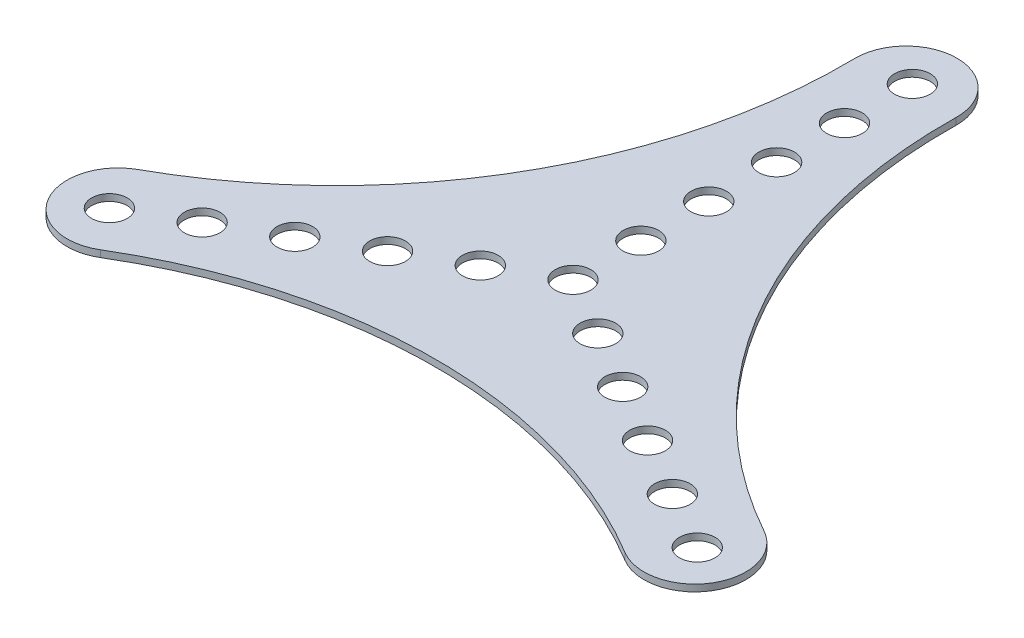
from build123d import *

# Parameters (mm, degrees)
BOSS_EXTRUDE1_DEPTH          = 1
CUT_EXTRUDE1_REACH           = 153.019
SKETCH2_R                    = 5.25
LPATTERN1_COUNT              = 6
LPATTERN1_PITCH              = 20
CIRPATTERN1_COPY_1_REACH     = 153.019
CIRPATTERN1_COPY_1_SKETCH_R  = 5.25
CIRPATTERN1_COPY_2_REACH     = 153.019
CIRPATTERN1_COPY_2_SKETCH_R  = 5.25
CIRPATTERN1_COPY_3_REACH     = 153.019
CIRPATTERN1_COPY_3_SKETCH_R  = 5.25
CIRPATTERN1_COPY_4_REACH     = 153.019
CIRPATTERN1_COPY_4_SKETCH_R  = 5.25
CIRPATTERN1_COPY_5_REACH     = 153.019
CIRPATTERN1_COPY_5_SKETCH_R  = 5.25
CIRPATTERN1_COPY_6_REACH     = 153.019
CIRPATTERN1_COPY_6_SKETCH_R  = 5.25
CIRPATTERN1_COPY_7_REACH     = 153.019
CIRPATTERN1_COPY_7_SKETCH_R  = 5.25
CIRPATTERN1_COPY_8_REACH     = 153.019
CIRPATTERN1_COPY_8_SKETCH_R  = 5.25
CIRPATTERN1_COPY_9_REACH     = 153.019
CIRPATTERN1_COPY_9_SKETCH_R  = 5.25
CIRPATTERN1_COPY_10_REACH    = 153.019
CIRPATTERN1_COPY_10_SKETCH_R = 5.25


with BuildPart() as part:
    # Sketch1 → Boss-Extrude1 (new, symmetric)
    with BuildSketch(Plane(origin=(0, 0, 0), x_dir=(1, 0, 0), z_dir=(0, 1, 0))):
        with BuildLine():
            ThreePointArc((-92.270407539, -35.95451472), (-97.990380878, -56.574773191), (-77.272726285, -61.931259218))
            ThreePointArc((-77.272726285, -61.931259218), (-7.65e-07, -40.496129118), (77.272724973, -61.931258429))
            ThreePointArc((77.272724973, -61.931258429), (97.990379986, -56.574774736), (92.270409321, -35.954515707))
            ThreePointArc((92.270409321, -35.954515707), (35.070677387, 20.248063146), (14.99768062, 97.88577308))
            ThreePointArc((14.99768062, 97.88577308), (9.1e-08, 113.149545762), (-14.997680623, 97.885773262))
            ThreePointArc((-14.997680623, 97.885773262), (-35.070676832, 20.248064107), (-92.270407539, -35.95451472))
        make_face()
    extrude(amount=BOSS_EXTRUDE1_DEPTH, both=True)

    # Sketch2 → Cut-Extrude1 (cut, up to next)
    with BuildSketch(Plane(origin=(0, 1, 0), x_dir=(1, 0, 0), z_dir=(0, 1, 0)), mode=Mode.PRIVATE) as cut_extrude1_sk1:
        with Locations(Location((0, 0, 0), (0, 0, 270))):
            Circle(SKETCH2_R)
    cut_extrude1_tool1 = extrude(cut_extrude1_sk1.sketch, amount=-CUT_EXTRUDE1_REACH, mode=Mode.PRIVATE) & part.part
    cut_extrude1 = cut_extrude1_tool1.solids().sort_by_distance((0, 1, 0))[0]
    add(cut_extrude1, mode=Mode.SUBTRACT)

    # LPattern1: Cut-Extrude1 ×6
    with Locations(*[(0, 0, -i * LPATTERN1_PITCH) for i in range(1, LPATTERN1_COUNT)]):
        add(cut_extrude1, mode=Mode.SUBTRACT)

    # CirPattern1 copy 1 sketch → CirPattern1 copy 1 (cut, up to next)
    with BuildSketch(Plane(origin=(-17.320508076, 1, 10), x_dir=(-0.4999999999999998, 0, -0.8660254037844387), z_dir=(0, 1, 0)), mode=Mode.PRIVATE) as cirpattern1_copy_1_sk1:
        with Locations(Location((0, 0, 0), (0, 0, 270))):
            Circle(CIRPATTERN1_COPY_1_SKETCH_R)
    cirpattern1_copy_1_tool1 = extrude(cirpattern1_copy_1_sk1.sketch, amount=-CIRPATTERN1_COPY_1_REACH, mode=Mode.PRIVATE) & part.part
    add(cirpattern1_copy_1_tool1.solids().sort_by_distance((-17.320508076, 1, 10))[0], mode=Mode.SUBTRACT)

    # CirPattern1 copy 2 sketch → CirPattern1 copy 2 (cut, up to next)
    with BuildSketch(Plane(origin=(17.320508076, 1, 10), x_dir=(-0.5000000000000004, 0, 0.8660254037844384), z_dir=(0, 1, 0)), mode=Mode.PRIVATE) as cirpattern1_copy_2_sk1:
        with Locations(Location((0, 0, 0), (0, 0, 270))):
            Circle(CIRPATTERN1_COPY_2_SKETCH_R)
    cirpattern1_copy_2_tool1 = extrude(cirpattern1_copy_2_sk1.sketch, amount=-CIRPATTERN1_COPY_2_REACH, mode=Mode.PRIVATE) & part.part
    add(cirpattern1_copy_2_tool1.solids().sort_by_distance((17.320508076, 1, 10))[0], mode=Mode.SUBTRACT)

    # CirPattern1 copy 3 sketch → CirPattern1 copy 3 (cut, up to next)
    with BuildSketch(Plane(origin=(-34.641016151, 1, 20), x_dir=(-0.4999999999999998, 0, -0.8660254037844387), z_dir=(0, 1, 0)), mode=Mode.PRIVATE) as cirpattern1_copy_3_sk1:
        with Locations(Location((0, 0, 0), (0, 0, 270))):
            Circle(CIRPATTERN1_COPY_3_SKETCH_R)
    cirpattern1_copy_3_tool1 = extrude(cirpattern1_copy_3_sk1.sketch, amount=-CIRPATTERN1_COPY_3_REACH, mode=Mode.PRIVATE) & part.part
    add(cirpattern1_copy_3_tool1.solids().sort_by_distance((-34.641016151, 1, 20))[0], mode=Mode.SUBTRACT)

    # CirPattern1 copy 4 sketch → CirPattern1 copy 4 (cut, up to next)
    with BuildSketch(Plane(origin=(34.641016151, 1, 20), x_dir=(-0.5000000000000004, 0, 0.8660254037844384), z_dir=(0, 1, 0)), mode=Mode.PRIVATE) as cirpattern1_copy_4_sk1:
        with Locations(Location((0, 0, 0), (0, 0, 270))):
            Circle(CIRPATTERN1_COPY_4_SKETCH_R)
    cirpattern1_copy_4_tool1 = extrude(cirpattern1_copy_4_sk1.sketch, amount=-CIRPATTERN1_COPY_4_REACH, mode=Mode.PRIVATE) & part.part
    add(cirpattern1_copy_4_tool1.solids().sort_by_distance((34.641016151, 1, 20))[0], mode=Mode.SUBTRACT)

    # CirPattern1 copy 5 sketch → CirPattern1 copy 5 (cut, up to next)
    with BuildSketch(Plane(origin=(-51.961524227, 1, 30), x_dir=(-0.4999999999999998, 0, -0.8660254037844387), z_dir=(0, 1, 0)), mode=Mode.PRIVATE) as cirpattern1_copy_5_sk1:
        with Locations(Location((0, 0, 0), (0, 0, 270))):
            Circle(CIRPATTERN1_COPY_5_SKETCH_R)
    cirpattern1_copy_5_tool1 = extrude(cirpattern1_copy_5_sk1.sketch, amount=-CIRPATTERN1_COPY_5_REACH, mode=Mode.PRIVATE) & part.part
    add(cirpattern1_copy_5_tool1.solids().sort_by_distance((-51.961524227, 1, 30))[0], mode=Mode.SUBTRACT)

    # CirPattern1 copy 6 sketch → CirPattern1 copy 6 (cut, up to next)
    with BuildSketch(Plane(origin=(51.961524227, 1, 30), x_dir=(-0.5000000000000004, 0, 0.8660254037844384), z_dir=(0, 1, 0)), mode=Mode.PRIVATE) as cirpattern1_copy_6_sk1:
        with Locations(Location((0, 0, 0), (0, 0, 270))):
            Circle(CIRPATTERN1_COPY_6_SKETCH_R)
    cirpattern1_copy_6_tool1 = extrude(cirpattern1_copy_6_sk1.sketch, amount=-CIRPATTERN1_COPY_6_REACH, mode=Mode.PRIVATE) & part.part
    add(cirpattern1_copy_6_tool1.solids().sort_by_distance((51.961524227, 1, 30))[0], mode=Mode.SUBTRACT)

    # CirPattern1 copy 7 sketch → CirPattern1 copy 7 (cut, up to next)
    with BuildSketch(Plane(origin=(-69.282032303, 1, 40), x_dir=(-0.4999999999999998, 0, -0.8660254037844387), z_dir=(0, 1, 0)), mode=Mode.PRIVATE) as cirpattern1_copy_7_sk1:
        with Locations(Location((0, 0, 0), (0, 0, 270))):
            Circle(CIRPATTERN1_COPY_7_SKETCH_R)
    cirpattern1_copy_7_tool1 = extrude(cirpattern1_copy_7_sk1.sketch, amount=-CIRPATTERN1_COPY_7_REACH, mode=Mode.PRIVATE) & part.part
    add(cirpattern1_copy_7_tool1.solids().sort_by_distance((-69.282032303, 1, 40))[0], mode=Mode.SUBTRACT)

    # CirPattern1 copy 8 sketch → CirPattern1 copy 8 (cut, up to next)
    with BuildSketch(Plane(origin=(69.282032303, 1, 40), x_dir=(-0.5000000000000004, 0, 0.8660254037844384), z_dir=(0, 1, 0)), mode=Mode.PRIVATE) as cirpattern1_copy_8_sk1:
        with Locations(Location((0, 0, 0), (0, 0, 270))):
            Circle(CIRPATTERN1_COPY_8_SKETCH_R)
    cirpattern1_copy_8_tool1 = extrude(cirpattern1_copy_8_sk1.sketch, amount=-CIRPATTERN1_COPY_8_REACH, mode=Mode.PRIVATE) & part.part
    add(cirpattern1_copy_8_tool1.solids().sort_by_distance((69.282032303, 1, 40))[0], mode=Mode.SUBTRACT)

    # CirPattern1 copy 9 sketch → CirPattern1 copy 9 (cut, up to next)
    with BuildSketch(Plane(origin=(-86.602540378, 1, 50), x_dir=(-0.4999999999999998, 0, -0.8660254037844387), z_dir=(0, 1, 0)), mode=Mode.PRIVATE) as cirpattern1_copy_9_sk1:
        with Locations(Location((0, 0, 0), (0, 0, 270))):
            Circle(CIRPATTERN1_COPY_9_SKETCH_R)
    cirpattern1_copy_9_tool1 = extrude(cirpattern1_copy_9_sk1.sketch, amount=-CIRPATTERN1_COPY_9_REACH, mode=Mode.PRIVATE) & part.part
    add(cirpattern1_copy_9_tool1.solids().sort_by_distance((-86.602540378, 1, 50))[0], mode=Mode.SUBTRACT)

    # CirPattern1 copy 10 sketch → CirPattern1 copy 10 (cut, up to next)
    with BuildSketch(Plane(origin=(86.602540378, 1, 50), x_dir=(-0.5000000000000004, 0, 0.8660254037844384), z_dir=(0, 1, 0)), mode=Mode.PRIVATE) as cirpattern1_copy_10_sk1:
        with Locations(Location((0, 0, 0), (0, 0, 270))):
            Circle(CIRPATTERN1_COPY_10_SKETCH_R)
    cirpattern1_copy_10_tool1 = extrude(cirpattern1_copy_10_sk1.sketch, amount=-CIRPATTERN1_COPY_10_REACH, mode=Mode.PRIVATE) & part.part
    add(cirpattern1_copy_10_tool1.solids().sort_by_distance((86.602540378, 1, 50))[0], mode=Mode.SUBTRACT)


solid = part.part
